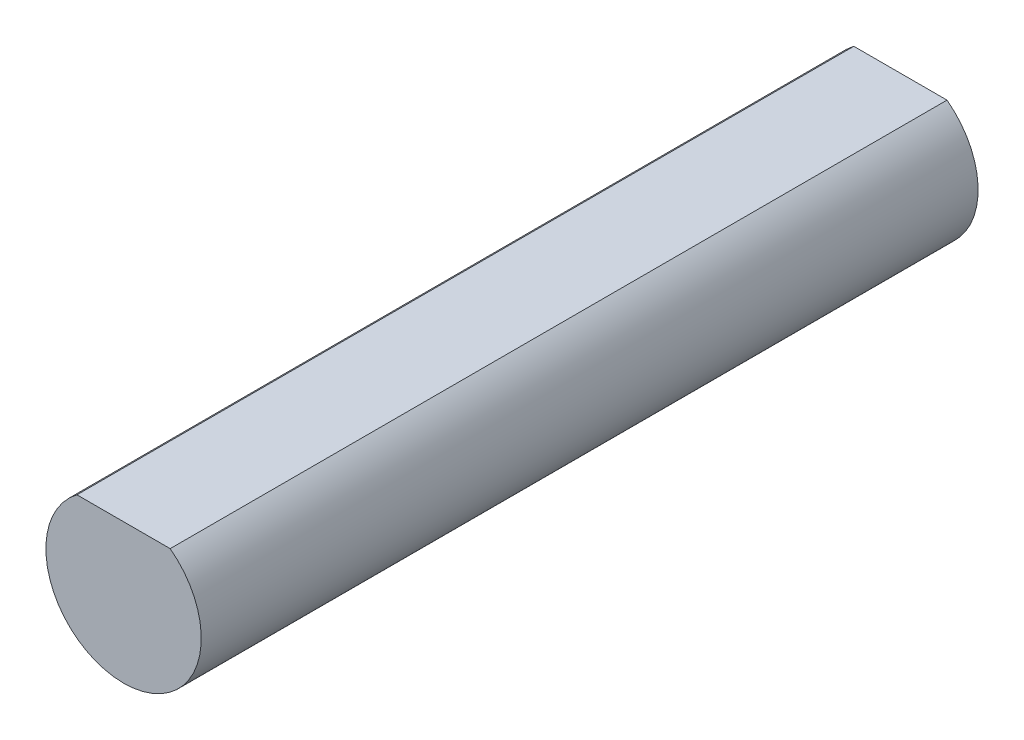
from build123d import *

# Parameters (mm, degrees)
BOSS_EXTRUDE1_DEPTH = 25


with BuildPart() as part:
    # Sketch1 → Boss-Extrude1 (new body)
    with BuildSketch(Plane.XY):
        with BuildLine():
            Line((1.5, 2), (-1.5, 2))
            ThreePointArc((-1.5, 2), (0, -2.5), (1.5, 2))
        make_face()
    extrude(amount=BOSS_EXTRUDE1_DEPTH)


solid = part.part
